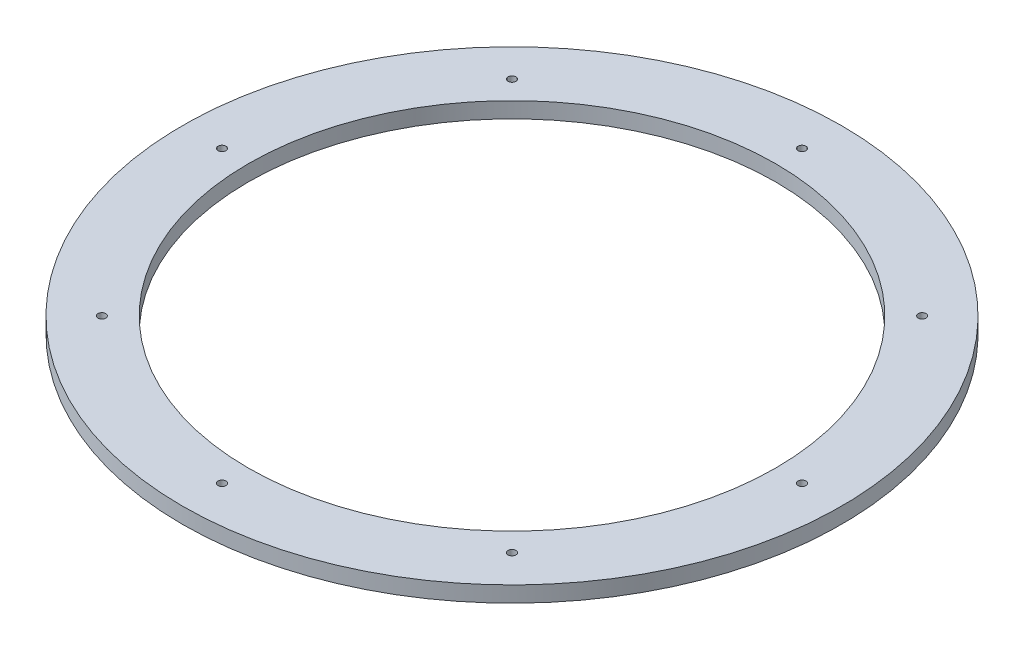
from build123d import *

# Parameters (mm, degrees)
SKETCH1_R           = 125
SKETCH1_R_2         = 100
SKETCH1_R_3         = 1.5
BOSS_EXTRUDE1_DEPTH = 6


with BuildPart() as part:
    # Sketch1 → Boss-Extrude1 (new body)
    with BuildSketch(Plane(origin=(0, 0, 0), x_dir=(1, 0, 0), z_dir=(0, 1, 0))):
        Circle(SKETCH1_R)
        Circle(SKETCH1_R_2, mode=Mode.SUBTRACT)
        with Locations((0, -110)):
            Circle(SKETCH1_R_3, mode=Mode.SUBTRACT)
        with Locations((77.781745931, -77.781745931)):
            Circle(SKETCH1_R_3, mode=Mode.SUBTRACT)
        with Locations((110, 0)):
            Circle(SKETCH1_R_3, mode=Mode.SUBTRACT)
        with Locations((77.781745931, 77.781745931)):
            Circle(SKETCH1_R_3, mode=Mode.SUBTRACT)
        with Locations((0, 110)):
            Circle(SKETCH1_R_3, mode=Mode.SUBTRACT)
        with Locations((-77.781745931, 77.781745931)):
            Circle(SKETCH1_R_3, mode=Mode.SUBTRACT)
        with Locations((-110, 0)):
            Circle(SKETCH1_R_3, mode=Mode.SUBTRACT)
        with Locations((-77.781745931, -77.781745931)):
            Circle(SKETCH1_R_3, mode=Mode.SUBTRACT)
    extrude(amount=BOSS_EXTRUDE1_DEPTH)


solid = part.part
